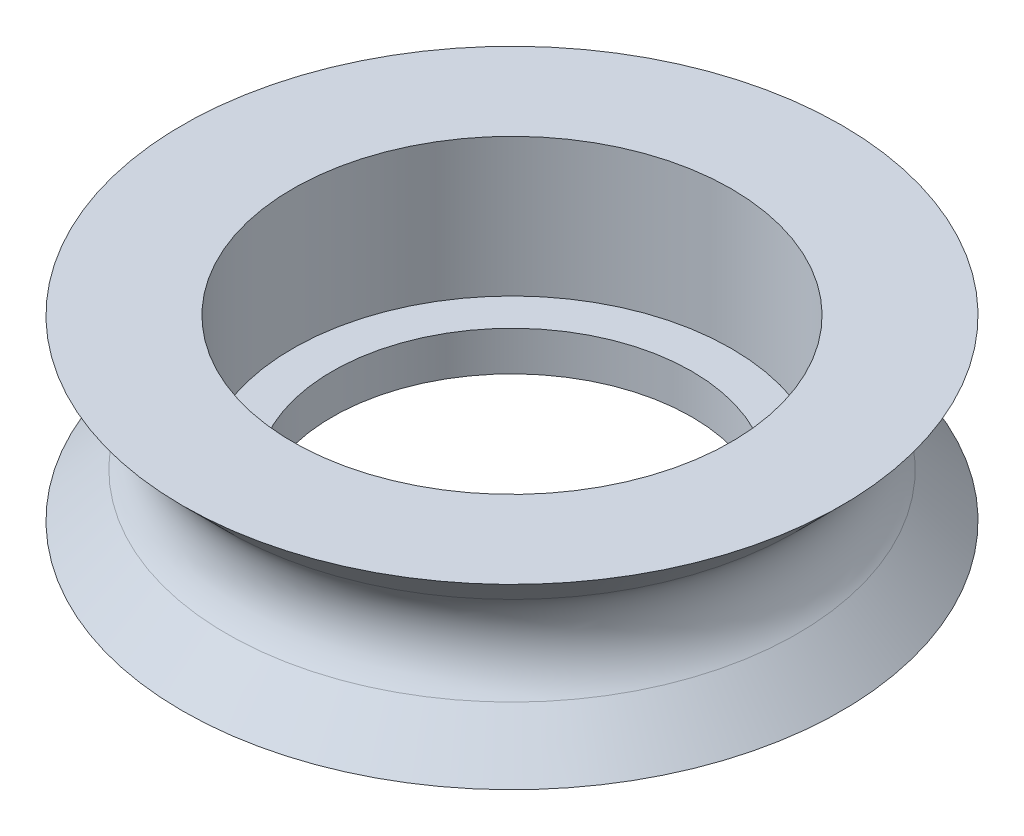
from build123d import *


with BuildPart() as part:
    # Sketch1 → Revolve1 (revolve)
    with BuildSketch(Plane.XY, mode=Mode.PRIVATE) as revolve1_sk:
        with BuildLine():
            Line((11.1, 0), (11.1, 7))
            Line((11.1, 7), (16.681980515, 7))
            Line((16.681980515, 7), (14.431980515, 4.75))
            ThreePointArc((14.431980515, 4.75), (13.5, 2.5), (14.431980515, 0.25))
            Line((14.431980515, 0.25), (16.681980515, -2))
            Line((16.681980515, -2), (9.1, -2))
            Line((9.1, -2), (9.1, 0))
            Line((9.1, 0), (11.1, 0))
        make_face()
    revolve(revolve1_sk.sketch.rotate(Axis((0, 0, 0), (0, 1, 0)), 90), axis=Axis((0, 0, 0), (0, 1, 0)))


solid = part.part
